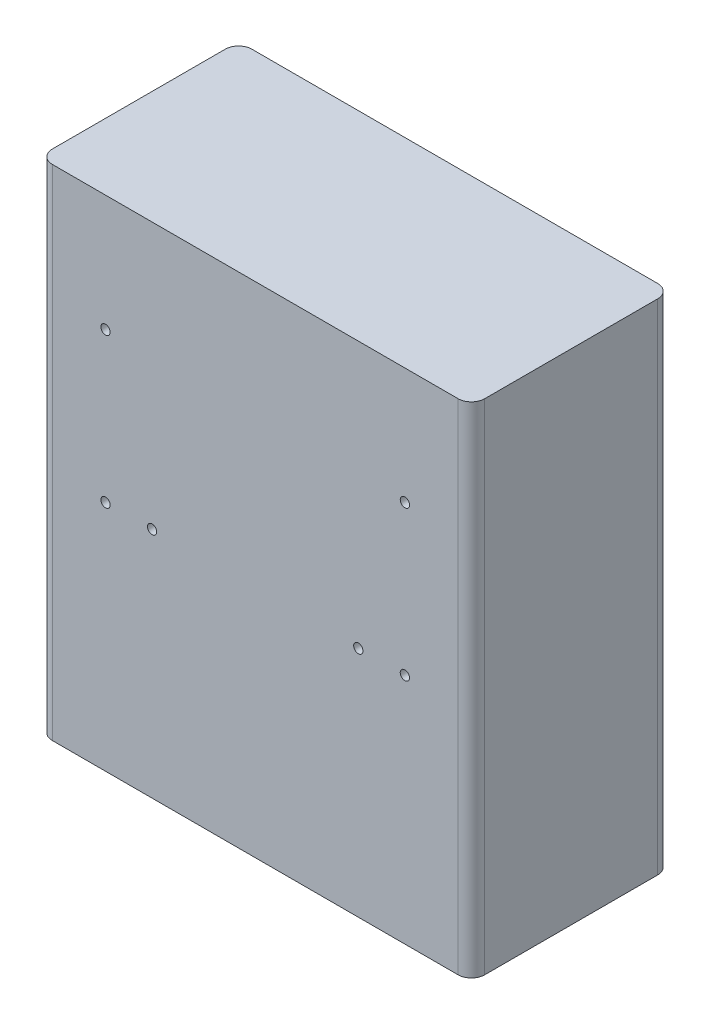
from build123d import *

# Parameters (mm, degrees)
SKETCH1_W           = 82.55
SKETCH1_H           = 95.25
BOSS_EXTRUDE1_DEPTH = 19.05
SKETCH2_R           = 0.889
CUT_EXTRUDE1_DEPTH  = 74.643575755
FILLET1_R           = 2.54


with BuildPart() as part:
    # Sketch1 → Boss-Extrude1 (new, symmetric)
    with BuildSketch(Plane.XY):
        Rectangle(SKETCH1_W, SKETCH1_H)
    extrude(amount=BOSS_EXTRUDE1_DEPTH, both=True)

    # Sketch2 → Cut-Extrude1 (cut, through all)
    with BuildSketch(Plane.XY.offset(19.05)):
        with Locations((-28.575, 25.4)):
            Circle(SKETCH2_R)
        with Locations((28.575, 25.4)):
            Circle(SKETCH2_R)
        with Locations((28.575, -3.175)):
            Circle(SKETCH2_R)
        with Locations((-28.575, -3.175)):
            Circle(SKETCH2_R)
        with Locations((-19.685, -3.175)):
            Circle(SKETCH2_R)
        with Locations((19.685, -3.175)):
            Circle(SKETCH2_R)
    extrude(amount=-CUT_EXTRUDE1_DEPTH, mode=Mode.SUBTRACT)

    # Fillet1
    fillet1_edges = [part.edges().sort_by_distance(p)[0] for p in [
        (-41.275, 0, 19.05),
        (41.275, 0, 19.05),
        (-41.275, 0, -19.05),
        (41.275, 0, -19.05),
    ]]
    fillet(fillet1_edges, radius=FILLET1_R)


solid = part.part
